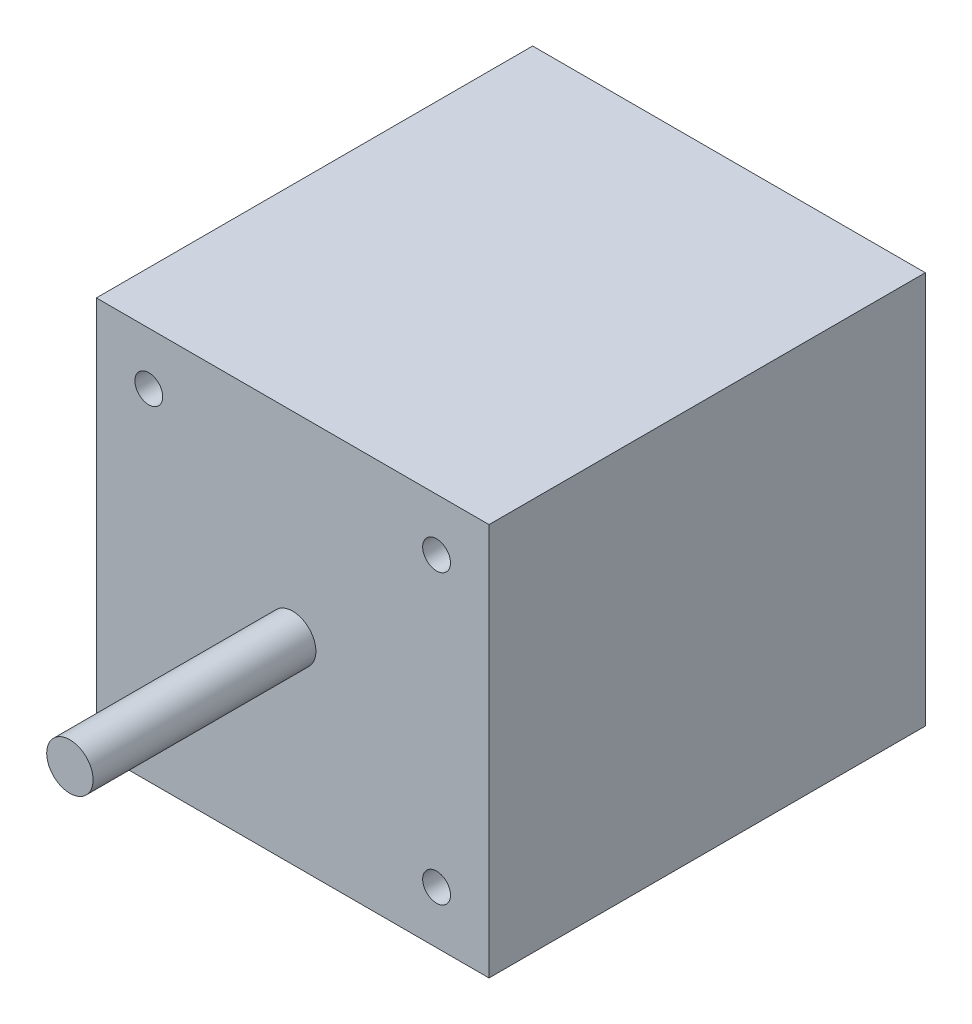
from build123d import *

# Parameters (mm, degrees)
SKETCH1_W           = 42.3
SKETCH1_H           = 42.3
BOSS_EXTRUDE1_DEPTH = 47
SKETCH2_R           = 2.5
BOSS_EXTRUDE2_DEPTH = 24
SKETCH3_R           = 1.5
CUT_EXTRUDE1_DEPTH  = 4.5


with BuildPart() as part:
    # Sketch1 → Boss-Extrude1 (new body)
    with BuildSketch(Plane.XY):
        with Locations((21.15, 21.15)):
            Rectangle(SKETCH1_W, SKETCH1_H)
    extrude(amount=BOSS_EXTRUDE1_DEPTH)

    # Sketch2 → Boss-Extrude2 (add)
    with BuildSketch(Plane.XY.offset(47)):
        with Locations(Location((21.15, 21.15, 0), (0, 0, 180))):
            Circle(SKETCH2_R)
    extrude(amount=BOSS_EXTRUDE2_DEPTH)

    # Sketch3 → Cut-Extrude1 (cut)
    with BuildSketch(Plane.XY.offset(47)):
        with Locations((5.65, 36.65)):
            Circle(SKETCH3_R)
        with Locations((36.65, 36.65)):
            Circle(SKETCH3_R)
        with Locations((36.65, 5.65)):
            Circle(SKETCH3_R)
        with Locations((5.65, 5.65)):
            Circle(SKETCH3_R)
    extrude(amount=-CUT_EXTRUDE1_DEPTH, mode=Mode.SUBTRACT)


solid = part.part
